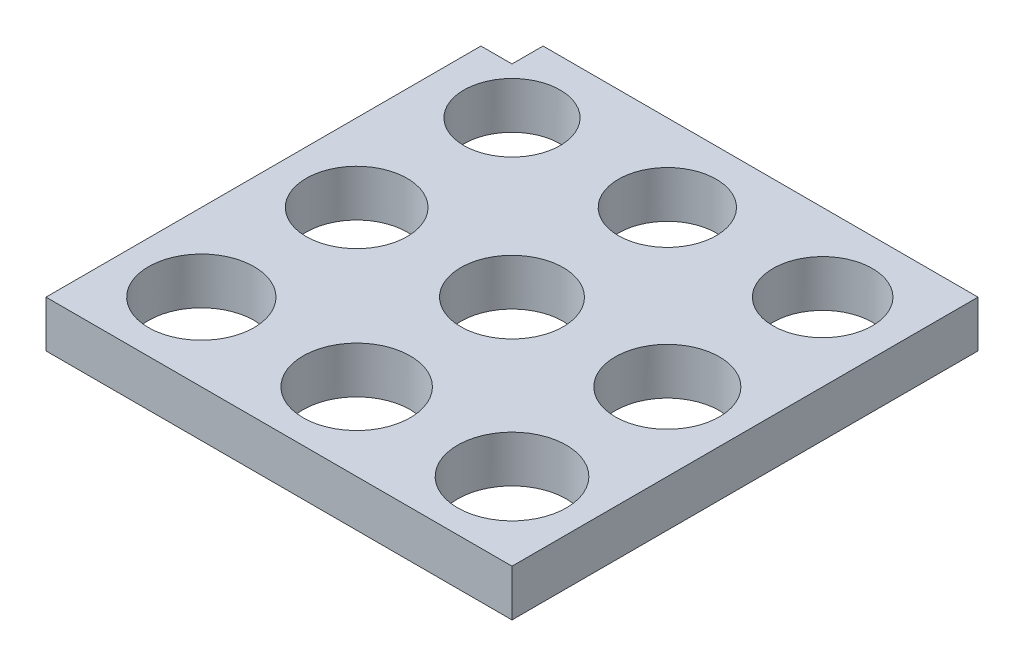
from build123d import *

# Parameters (mm, degrees)
SKETCH1_W           = 15
SKETCH1_H           = 15
BOSS_EXTRUDE1_DEPTH = 1.5
SKETCH2_R           = 1.55
SKETCH2_R_2         = 1.575
SKETCH2_R_3         = 1.6
SKETCH2_R_4         = 1.625
SKETCH2_R_5         = 1.65
SKETCH2_R_6         = 1.675
SKETCH2_R_7         = 1.7
SKETCH2_R_8         = 1.725
SKETCH2_R_9         = 1.75
CUT_EXTRUDE1_DEPTH  = 10
SKETCH4_W           = 1
SKETCH4_H           = 1
CUT_EXTRUDE2_DEPTH  = 10


with BuildPart() as part:
    # Sketch1 → Boss-Extrude1 (new body)
    with BuildSketch(Plane(origin=(0, 0, 0), x_dir=(1, 0, 0), z_dir=(0, 1, 0))):
        Rectangle(SKETCH1_W, SKETCH1_H)
    extrude(amount=BOSS_EXTRUDE1_DEPTH)

    # Sketch2 → Cut-Extrude1 (cut)
    with BuildSketch(Plane(origin=(0, 1.5, 0), x_dir=(1, 0, 0), z_dir=(0, 1, 0))):
        with Locations((-5, 5)):
            Circle(SKETCH2_R)
        with Locations((0, 5)):
            Circle(SKETCH2_R_2)
        with Locations((5, 5)):
            Circle(SKETCH2_R_3)
        with Locations((-5, 0)):
            Circle(SKETCH2_R_4)
        Circle(SKETCH2_R_5)
        with Locations((5, 0)):
            Circle(SKETCH2_R_6)
        with Locations((-5, -5)):
            Circle(SKETCH2_R_7)
        with Locations((0, -5)):
            Circle(SKETCH2_R_8)
        with Locations((5, -5)):
            Circle(SKETCH2_R_9)
    extrude(amount=-CUT_EXTRUDE1_DEPTH, mode=Mode.SUBTRACT)

    # Sketch4 → Cut-Extrude2 (cut)
    with BuildSketch(Plane(origin=(0, 1.5, 0), x_dir=(1, 0, 0), z_dir=(0, 1, 0))):
        with Locations((-7, 7)):
            Rectangle(SKETCH4_W, SKETCH4_H)
    extrude(amount=-CUT_EXTRUDE2_DEPTH, mode=Mode.SUBTRACT)


solid = part.part
